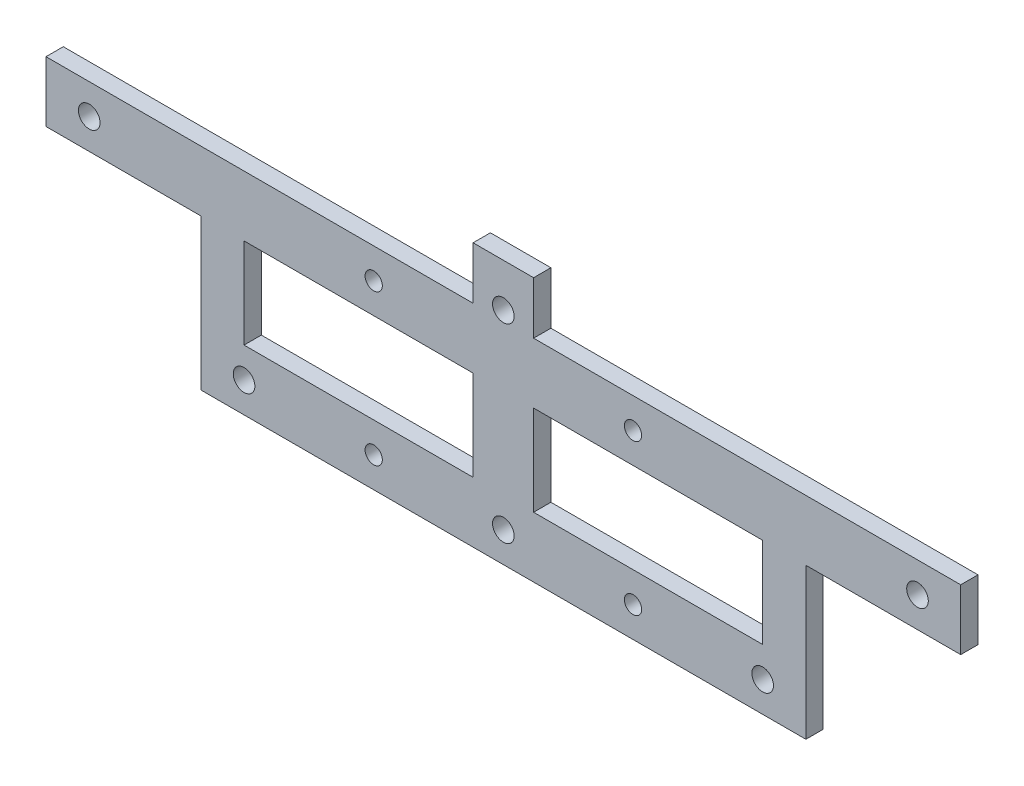
from build123d import *

# Parameters (mm, degrees)
SKETCH1_R           = 2.5
SKETCH1_R_2         = 2
SKETCH1_W           = 10
SKETCH1_H           = 20.877946607
SKETCH1_W_2         = 140
SKETCH1_H_2         = 14
BOSS_EXTRUDE1_DEPTH = 4


with BuildPart() as part:
    # Sketch1 → Boss-Extrude1 (new body)
    # profile 1 of 6: a face of its own
    with BuildSketch(Plane.XY):
        Polygon((-105.826370741, 27.877946607), (-70, 27.877946607), (-60, 27.877946607), (-7, 27.877946607), (-7, 41.877946607), (-105.826370741, 41.877946607), align=None)
        with Locations((-95.826370741, 34.877946607)):
            Circle(SKETCH1_R, mode=Mode.SUBTRACT)
        with Locations((-30, 34.877946607)):
            Circle(SKETCH1_R_2, mode=Mode.SUBTRACT)
    # profile 2 of 6: a face of its own
    with BuildSketch(Plane.XY):
        with Locations((-65, 17.438973303)):
            Rectangle(SKETCH1_W, SKETCH1_H)
    # profile 3 of 6: a face of its own
    with BuildSketch(Plane.XY):
        Rectangle(SKETCH1_W_2, SKETCH1_H_2)
        with Locations((30, 0)):
            Circle(SKETCH1_R_2, mode=Mode.SUBTRACT)
        with Locations((-30, 0)):
            Circle(SKETCH1_R_2, mode=Mode.SUBTRACT)
        with Locations((-60, 0)):
            Circle(SKETCH1_R, mode=Mode.SUBTRACT)
        Circle(SKETCH1_R, mode=Mode.SUBTRACT)
        with Locations((60, 0)):
            Circle(SKETCH1_R, mode=Mode.SUBTRACT)
    # profile 4 of 6: a face of its own
    with BuildSketch(Plane.XY):
        Polygon((-7, 27.877946607), (-7, 7), (7, 7), (7, 27.877946607), (7, 41.877946607), (7, 54), (-7, 54), (-7, 41.877946607), align=None)
        with Locations((0, 44)):
            Circle(SKETCH1_R, mode=Mode.SUBTRACT)
    # profile 5 of 6: a face of its own
    with BuildSketch(Plane.XY):
        Polygon((7, 41.877946607), (7, 27.877946607), (60, 27.877946607), (70, 27.877946607), (105.826370741, 27.877946607), (105.826370741, 41.877946607), align=None)
        with Locations((30, 34.877946607)):
            Circle(SKETCH1_R_2, mode=Mode.SUBTRACT)
        with Locations((95.826370741, 34.877946607)):
            Circle(SKETCH1_R, mode=Mode.SUBTRACT)
    # profile 6 of 6: a face of its own
    with BuildSketch(Plane.XY):
        with Locations((65, 17.438973303)):
            Rectangle(SKETCH1_W, SKETCH1_H)
    extrude(amount=BOSS_EXTRUDE1_DEPTH)


solid = part.part
